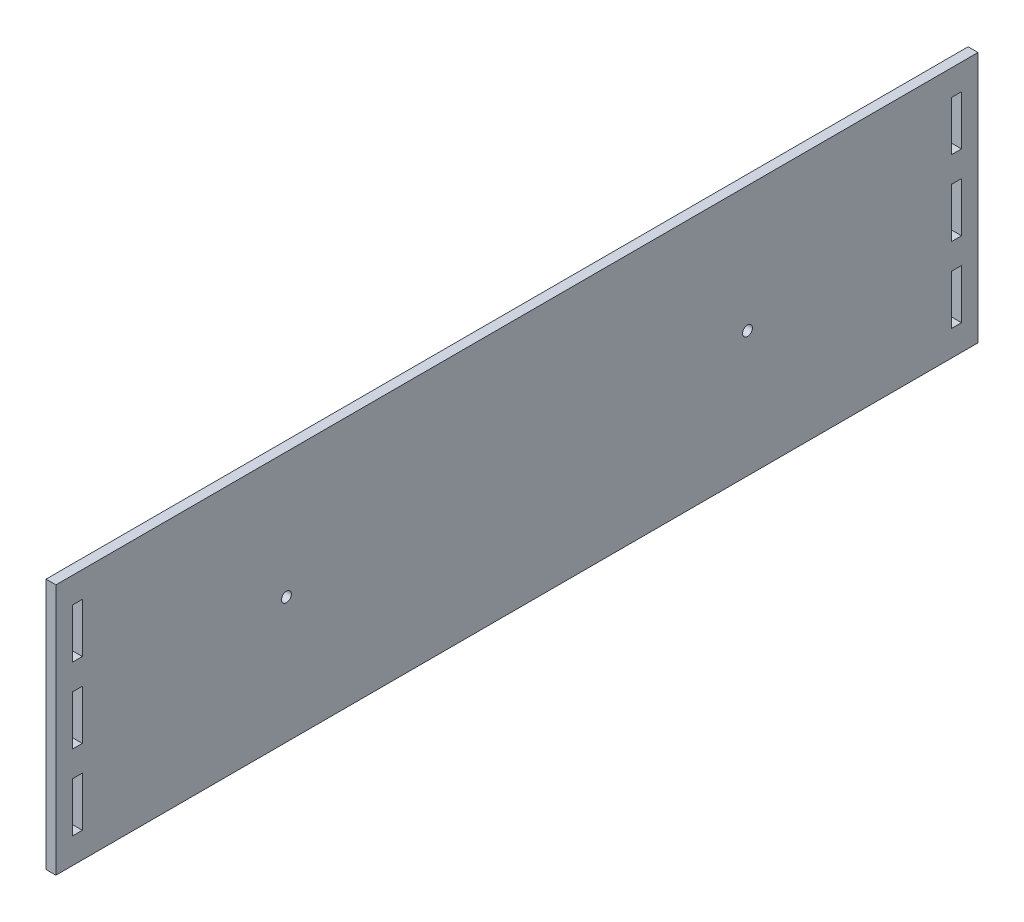
from build123d import *

# Parameters (mm, degrees)
SKETCH1_W                       = 279.4
SKETCH1_H                       = 76.2
BOSS_EXTRUDE1_DEPTH             = 3
SKETCH3_W                       = 3
SKETCH3_H                       = 15
CUT_EXTRUDE1_DEPTH              = 145.833352512
LPATTERN1_COUNT                 = 3
LPATTERN1_PITCH                 = 22.8
MIRROR1_COPY_1_SKETCH_W         = 3
MIRROR1_COPY_1_SKETCH_H         = 15
MIRROR1_COPY_1_DEPTH            = 145.833352512
MIRROR1_COPY_2_SKETCH_W         = 3
MIRROR1_COPY_2_SKETCH_H         = 15
MIRROR1_COPY_2_DEPTH            = 145.833352512
F_3_0MM_CLEARANCE_DOWEL_HOLE1_D = 3


with BuildPart() as part:
    # Sketch1 → Boss-Extrude1 (new body)
    with BuildSketch(Plane(origin=(0, 0, 0), x_dir=(0, 0, -1), z_dir=(1, 0, 0))):
        Rectangle(SKETCH1_W, SKETCH1_H)
    extrude(amount=-BOSS_EXTRUDE1_DEPTH)

    # Sketch3 → Cut-Extrude1 (cut, through all)
    with BuildSketch(Plane.ZY.offset(3)):
        with Locations((133.2, 22.8)):
            Rectangle(SKETCH3_W, SKETCH3_H)
    cut_extrude1 = extrude(amount=-CUT_EXTRUDE1_DEPTH, mode=Mode.SUBTRACT)

    # LPattern1: Cut-Extrude1 ×3
    with Locations(*[(0, -i * LPATTERN1_PITCH, 0) for i in range(1, LPATTERN1_COUNT)]):
        add(cut_extrude1, mode=Mode.SUBTRACT)

    # Mirror1: Cut-Extrude1 across plane
    add(cut_extrude1.mirror(Plane.XY), mode=Mode.SUBTRACT)

    # Mirror1 copy 1 sketch → Mirror1 copy 1 (cut, through all)
    with BuildSketch(Plane(origin=(-3, -22.8, 0), x_dir=(0, 0, -1), z_dir=(-1, 0, 0))):
        with Locations((133.2, -22.8)):
            Rectangle(MIRROR1_COPY_1_SKETCH_W, MIRROR1_COPY_1_SKETCH_H)
    extrude(amount=-MIRROR1_COPY_1_DEPTH, mode=Mode.SUBTRACT)

    # Mirror1 copy 2 sketch → Mirror1 copy 2 (cut, through all)
    with BuildSketch(Plane(origin=(-3, -45.6, 0), x_dir=(0, 0, -1), z_dir=(-1, 0, 0))):
        with Locations((133.2, -22.8)):
            Rectangle(MIRROR1_COPY_2_SKETCH_W, MIRROR1_COPY_2_SKETCH_H)
    extrude(amount=-MIRROR1_COPY_2_DEPTH, mode=Mode.SUBTRACT)

    # Ø3.0mm Clearance Dowel Hole1 (through all)
    with Locations(Plane.ZY.offset(3)):
        with Locations((-69.85, 0), (69.85, 0)):
            Hole(F_3_0MM_CLEARANCE_DOWEL_HOLE1_D / 2)


solid = part.part
